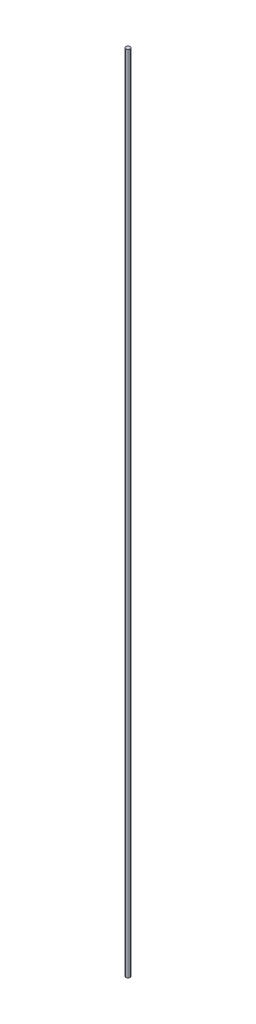
from build123d import *

# Parameters (mm, degrees)
SWEEP1_PROFILE_R = 6.35


with BuildPart() as part:
    # Sweep1: sweep along a path in Sketch1
    with BuildLine(Plane.XY) as sweep1_path:
        Line((0, 0), (0, 2457.196))
    # Sweep1 profile (on start of the path) → Sweep1 (sweep)
    with BuildSketch(Plane.ZX):
        Circle(SWEEP1_PROFILE_R)
    sweep(path=sweep1_path.line)


solid = part.part
